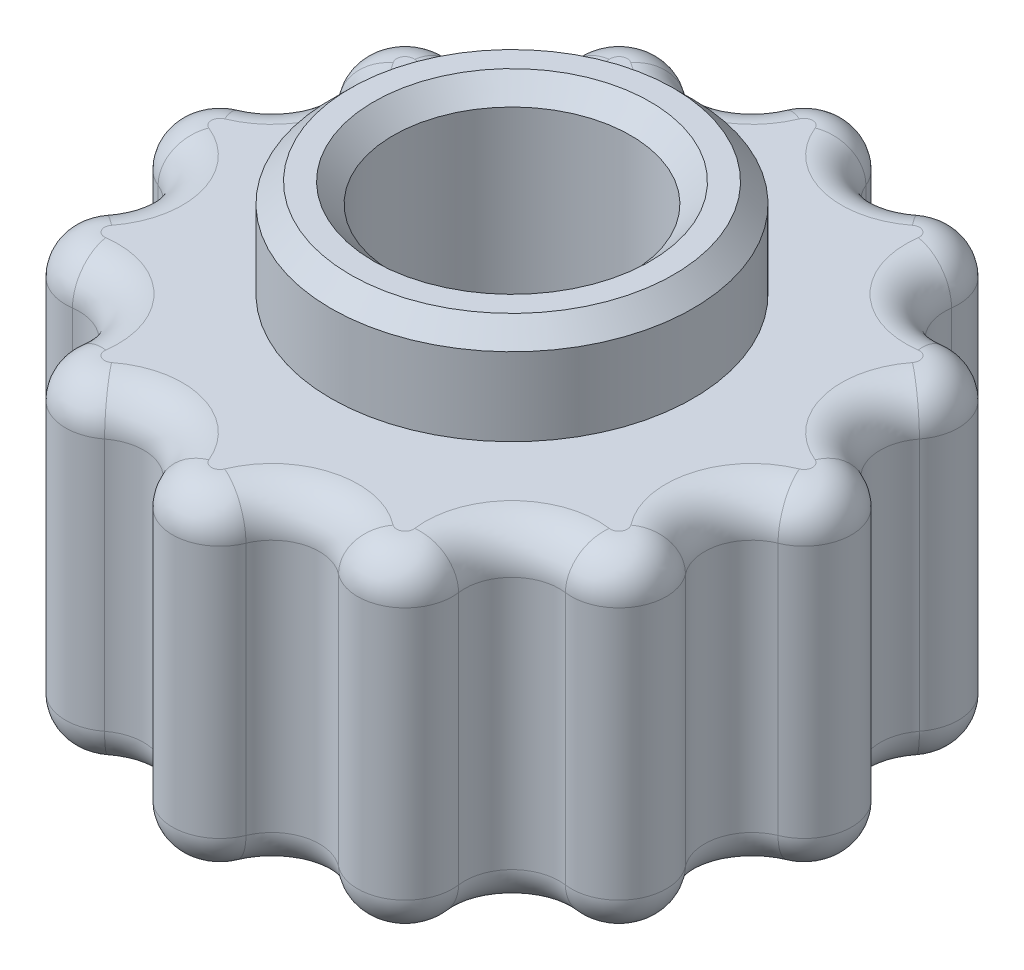
from build123d import *

# Parameters (mm, degrees)
EXTRUDE_1_DEPTH     = 8.5
SKETCH_2_R          = 4.65
EXTRUDE_2_DEPTH     = 2.5
FILLET_1_R          = 1
SKETCH_3_R          = 3.05
CUT_EXTRUDE_1_DEPTH = 10
CHAMFER_1_SIZE      = 0.5


with BuildPart() as part:
    # Эскиз1 → Бобышка-Вытянуть1 (new body)
    with BuildSketch(Plane(origin=(0, 0, 0), x_dir=(1, 0, 0), z_dir=(0, 1, 0))):
        with BuildLine():
            ThreePointArc((-3.003293239, 7.458442957), (-1.941142838, 7.244443697), (-1.128293239, 7.960847693))
            ThreePointArc((-1.128293239, 7.960847693), (0, 8.718780632), (1.128293239, 7.960847693))
            ThreePointArc((1.128293239, 7.960847693), (1.941142838, 7.244443697), (3.003293239, 7.458442957))
            ThreePointArc((3.003293239, 7.458442957), (4.359390316, 7.550685517), (4.957554454, 6.330149718))
            ThreePointArc((4.957554454, 6.330149718), (5.303300859, 5.303300859), (6.330149718, 4.957554454))
            ThreePointArc((6.330149718, 4.957554454), (7.550685517, 4.359390316), (7.458442957, 3.003293239))
            ThreePointArc((7.458442957, 3.003293239), (7.244443697, 1.941142838), (7.960847693, 1.128293239))
            ThreePointArc((7.960847693, 1.128293239), (8.718780632, 0), (7.960847693, -1.128293239))
            ThreePointArc((7.960847693, -1.128293239), (7.244443697, -1.941142838), (7.458442957, -3.003293239))
            ThreePointArc((7.458442957, -3.003293239), (7.550685517, -4.359390316), (6.330149718, -4.957554454))
            ThreePointArc((6.330149718, -4.957554454), (5.303300859, -5.303300859), (4.957554454, -6.330149718))
            ThreePointArc((4.957554454, -6.330149718), (4.359390316, -7.550685517), (3.003293239, -7.458442957))
            ThreePointArc((3.003293239, -7.458442957), (1.941142838, -7.244443697), (1.128293239, -7.960847693))
            ThreePointArc((1.128293239, -7.960847693), (0, -8.718780632), (-1.128293239, -7.960847693))
            ThreePointArc((-1.128293239, -7.960847693), (-1.941142838, -7.244443697), (-3.003293239, -7.458442957))
            ThreePointArc((-3.003293239, -7.458442957), (-4.359390316, -7.550685517), (-4.957554454, -6.330149718))
            ThreePointArc((-4.957554454, -6.330149718), (-5.303300859, -5.303300859), (-6.330149718, -4.957554454))
            ThreePointArc((-6.330149718, -4.957554454), (-7.550685517, -4.359390316), (-7.458442957, -3.003293239))
            ThreePointArc((-7.458442957, -3.003293239), (-7.244443697, -1.941142838), (-7.960847693, -1.128293239))
            ThreePointArc((-7.960847693, -1.128293239), (-8.718780632, 0), (-7.960847693, 1.128293239))
            ThreePointArc((-7.960847693, 1.128293239), (-7.244443697, 1.941142838), (-7.458442957, 3.003293239))
            ThreePointArc((-7.458442957, 3.003293239), (-7.550685517, 4.359390316), (-6.330149718, 4.957554454))
            ThreePointArc((-6.330149718, 4.957554454), (-5.303300859, 5.303300859), (-4.957554454, 6.330149718))
            ThreePointArc((-4.957554454, 6.330149718), (-4.359390316, 7.550685517), (-3.003293239, 7.458442957))
        make_face()
    extrude(amount=EXTRUDE_1_DEPTH)

    # Эскиз2 → Бобышка-Вытянуть2 (add)
    with BuildSketch(Plane(origin=(0, 8.5, 0), x_dir=(1, 0, 0), z_dir=(0, 1, 0))):
        Circle(SKETCH_2_R)
    extrude(amount=EXTRUDE_2_DEPTH)

    # Скругление1
    fillet_1_edges = [part.edges().sort_by_distance(p)[0] for p in [
        (7.550685517, 8.5, -4.359390316),
        (5.303300859, 8.5, -5.303300859),
        (4.359390316, 8.5, -7.550685517),
        (1.941142838, 8.5, -7.244443697),
        (0, 8.5, -8.718780632),
        (-1.941142838, 8.5, -7.244443697),
        (-4.359390316, 8.5, -7.550685517),
        (-5.303300859, 8.5, -5.303300859),
        (-7.550685517, 8.5, -4.359390316),
        (-7.244443697, 8.5, -1.941142838),
        (-8.718780632, 8.5, 0),
        (-7.244443697, 8.5, 1.941142838),
        (-7.550685517, 8.5, 4.359390316),
        (-5.303300859, 8.5, 5.303300859),
        (-4.359390316, 8.5, 7.550685517),
        (-1.941142838, 8.5, 7.244443697),
        (0, 8.5, 8.718780632),
        (1.941142838, 8.5, 7.244443697),
        (4.359390316, 8.5, 7.550685517),
        (5.303300859, 8.5, 5.303300859),
        (7.550685517, 8.5, 4.359390316),
        (7.244443697, 8.5, 1.941142838),
        (8.718780632, 8.5, 0),
        (7.550685517, 0, -4.359390316),
        (5.303300859, 0, -5.303300859),
        (4.359390316, 0, -7.550685517),
        (1.941142838, 0, -7.244443697),
        (0, 0, -8.718780632),
        (-1.941142838, 0, -7.244443697),
        (-4.359390316, 0, -7.550685517),
        (-5.303300859, 0, -5.303300859),
        (-7.550685517, 0, -4.359390316),
        (-7.244443697, 0, -1.941142838),
        (-8.718780632, 0, 0),
        (-7.244443697, 0, 1.941142838),
        (-7.550685517, 0, 4.359390316),
        (-5.303300859, 0, 5.303300859),
        (-4.359390316, 0, 7.550685517),
        (-1.941142838, 0, 7.244443697),
        (0, 0, 8.718780632),
        (1.941142838, 0, 7.244443697),
        (4.359390316, 0, 7.550685517),
        (5.303300859, 0, 5.303300859),
        (7.550685517, 0, 4.359390316),
        (7.244443697, 0, 1.941142838),
        (8.718780632, 0, 0),
        (7.244443697, 8.5, -1.941142838),
        (7.244443697, 0, -1.941142838),
    ]]
    fillet(fillet_1_edges, radius=FILLET_1_R)

    # Эскиз3 → Вырез-Вытянуть1 (cut)
    with BuildSketch(Plane(origin=(0, 11, 0), x_dir=(1, 0, 0), z_dir=(0, 1, 0))):
        Circle(SKETCH_3_R)
    extrude(amount=-CUT_EXTRUDE_1_DEPTH, mode=Mode.SUBTRACT)

    # Фаска1
    chamfer_1_edges = [part.edges().sort_by_distance(p)[0] for p in [
        (-4.65, 11, 0),
        (-3.05, 11, 0),
    ]]
    chamfer(chamfer_1_edges, length=CHAMFER_1_SIZE)


solid = part.part
